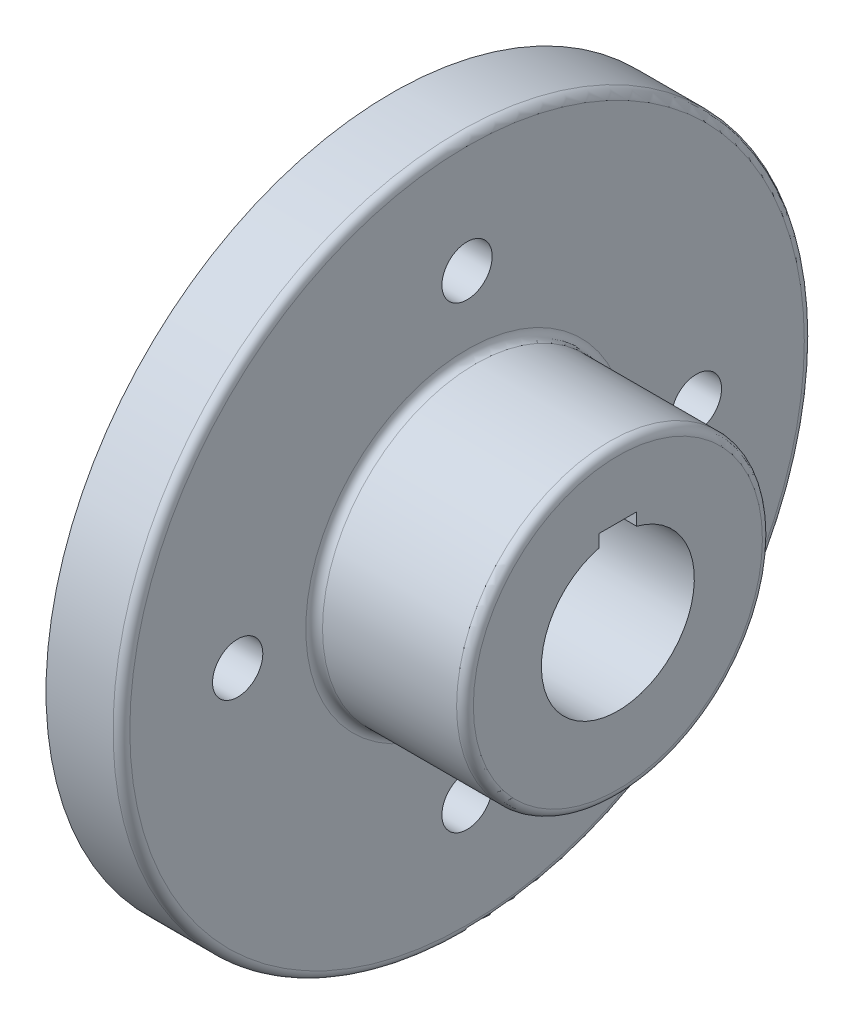
from build123d import *

# Parameters (mm, degrees)
SKETCH1_R           = 82.5
BOSS_EXTRUDE1_DEPTH = 18
SKETCH2_R           = 36.5
BOSS_EXTRUDE2_DEPTH = 36
SKETCH3_R           = 18.25
CUT_EXTRUDE1_DEPTH  = 129.563214023
SKETCH4_R           = 6
CUT_EXTRUDE2_DEPTH  = 129.563214023
FILLET1_R           = 2
SKETCH5_W           = 9
SKETCH5_H           = 3
CUT_EXTRUDE3_DEPTH  = 129.563214023


with BuildPart() as part:
    # Sketch1 → Boss-Extrude1 (new body)
    with BuildSketch(Plane(origin=(0, 0, 0), x_dir=(0, 0, -1), z_dir=(1, 0, 0))):
        Circle(SKETCH1_R)
    extrude(amount=BOSS_EXTRUDE1_DEPTH)

    # Sketch2 → Boss-Extrude2 (add)
    with BuildSketch(Plane(origin=(18, 0, 0), x_dir=(0, 0, -1), z_dir=(1, 0, 0))):
        Circle(SKETCH2_R)
    extrude(amount=BOSS_EXTRUDE2_DEPTH)

    # Sketch3 → Cut-Extrude1 (cut, through all)
    with BuildSketch(Plane.ZY):
        Circle(SKETCH3_R)
    extrude(amount=-CUT_EXTRUDE1_DEPTH, mode=Mode.SUBTRACT)

    # Sketch4 → Cut-Extrude2 (cut, through all)
    with BuildSketch(Plane.ZY):
        with Locations((0, -54.75)):
            Circle(SKETCH4_R)
        with Locations((-54.75, 0)):
            Circle(SKETCH4_R)
        with Locations((0, 54.75)):
            Circle(SKETCH4_R)
        with Locations((54.75, 0)):
            Circle(SKETCH4_R)
    extrude(amount=-CUT_EXTRUDE2_DEPTH, mode=Mode.SUBTRACT)

    # Fillet1
    fillet1_edges = [part.edges().sort_by_distance(p)[0] for p in [
        (18, 0, 82.5),
        (18, 0, 36.5),
        (54, 0, 36.5),
    ]]
    fillet(fillet1_edges, radius=FILLET1_R)

    # Sketch5 → Cut-Extrude3 (cut, through all)
    with BuildSketch(Plane.ZY):
        with Locations((0, 19.186506156)):
            Rectangle(SKETCH5_W, SKETCH5_H)
    extrude(amount=-CUT_EXTRUDE3_DEPTH, mode=Mode.SUBTRACT)


solid = part.part
